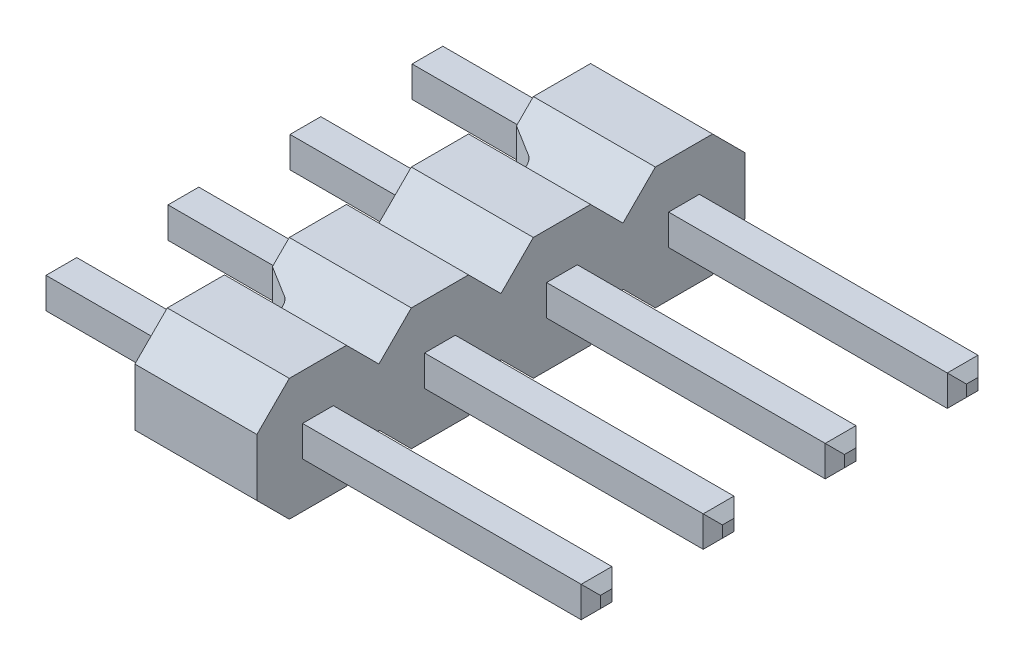
from build123d import *

# Parameters (mm, degrees)
CROQUIS1_W                     = 0.64
CROQUIS1_H                     = 0.64
SALIENTE_EXTRUIR1_DEPTH        = 2.54
CORTAR_EXTRUIR1_DEPTH          = 2.54
CORTAR_EXTRUIR1_DEPTH_BACK     = 2.54
SALIENTE_EXTRUIR2_DEPTH        = 8.54
SALIENTE_EXTRUIR2_DEPTH_BACK   = 3
CROQUIS3_W                     = 0.64
CROQUIS3_H                     = 0.64
SALIENTE_EXTRUIR2_2_DEPTH      = 8.54
SALIENTE_EXTRUIR2_2_DEPTH_BACK = 3
CHAFL_N1_SIZE                  = 0.2
CHAFL_N2_SIZE                  = 0.2


with BuildPart() as part:
    # Croquis1 → Saliente-Extruir1 (new body)
    # profile 1 of 2: a face of its own
    with BuildSketch(Plane(origin=(0, 0, 0), x_dir=(0, 0, -1), z_dir=(1, 0, 0))):
        Polygon((1.27, 0.595482683), (1.27, -0.595482683), (0.595482683, -1.27), (-0.595482683, -1.27), (-1.27, -0.595482683), (-1.27, 0.595482683), (-0.595482683, 1.27), (0.595482683, 1.27), align=None)
        Rectangle(CROQUIS1_W, CROQUIS1_H, mode=Mode.SUBTRACT)
    # profile 2 of 2: a face of its own
    with BuildSketch(Plane(origin=(0, 0, 0), x_dir=(0, 0, -1), z_dir=(1, 0, 0))):
        Polygon((3.135482683, 1.27), (3.81, 0.595482683), (3.81, -0.595482683), (3.135482683, -1.27), (1.944517317, -1.27), (1.27, -0.595482683), (1.27, 0.595482683), (1.944517317, 1.27), align=None)
        with Locations((2.54, 0)):
            Rectangle(CROQUIS1_W, CROQUIS1_H, mode=Mode.SUBTRACT)
    extrude(amount=SALIENTE_EXTRUIR1_DEPTH)

    # Croquis2 → Cortar-Extruir1 (cut, two sides: drawn at the far end of the back side and taken through both)
    with BuildSketch(Plane(origin=(0, 0, 0), x_dir=(1, 0, 0), z_dir=(0, 1, 0)).offset(-CORTAR_EXTRUIR1_DEPTH_BACK)):
        with BuildLine():
            Line((0.516526244, 1.243275937), (0.516526244, 1.296724063))
            ThreePointArc((0.516526244, 1.296724063), (0.500491193, 1.351036929), (0.457528496, 1.387931603))
            Line((0.457528496, 1.387931603), (0, 1.593613049))
            Line((0, 1.593613049), (0, 0.946386951))
            Line((0, 0.946386951), (0.457528496, 1.152068397))
            ThreePointArc((0.457528496, 1.152068397), (0.500491193, 1.188963071), (0.516526244, 1.243275937))
        make_face()
    extrude(amount=CORTAR_EXTRUIR1_DEPTH + CORTAR_EXTRUIR1_DEPTH_BACK, mode=Mode.SUBTRACT)

    # Mirror5: part across plane


with BuildPart() as body_2:
    # Croquis3 → Saliente-Extruir2 (new, two sides: drawn at the far end of the back side and taken through both)
    with BuildSketch(Plane(origin=(0, 0, 0), x_dir=(0, 0, -1), z_dir=(1, 0, 0)).offset(-SALIENTE_EXTRUIR2_DEPTH_BACK)):
        Rectangle(CROQUIS3_W, CROQUIS3_H)
    extrude(amount=SALIENTE_EXTRUIR2_DEPTH + SALIENTE_EXTRUIR2_DEPTH_BACK)

    # Chaflán1
    chafl_n1_edges = [body_2.edges().sort_by_distance(p)[0] for p in [
        (-3, 0, -0.32),
        (8.54, 0, 0.32),
        (8.54, -0.32, 0),
        (-3, 0.32, 0),
        (8.54, 0, -0.32),
        (8.54, 0.32, 0),
        (-3, 0, 0.32),
        (-3, -0.32, 0),
    ]]
    chamfer(chafl_n1_edges, length=CHAFL_N1_SIZE)


with BuildPart() as body_3:
    # Croquis3 → Saliente-Extruir2 2 (new, two sides: drawn at the far end of the back side and taken through both)
    with BuildSketch(Plane(origin=(0, 0, 0), x_dir=(0, 0, -1), z_dir=(1, 0, 0)).offset(-SALIENTE_EXTRUIR2_2_DEPTH_BACK)):
        with Locations((2.54, 0)):
            Rectangle(CROQUIS3_W, CROQUIS3_H)
    extrude(amount=SALIENTE_EXTRUIR2_2_DEPTH + SALIENTE_EXTRUIR2_2_DEPTH_BACK)

    # Chaflán2
    chafl_n2_edges = [body_3.edges().sort_by_distance(p)[0] for p in [
        (-3, 0, -2.86),
        (8.54, 0, -2.22),
        (8.54, -0.32, -2.54),
        (-3, 0.32, -2.54),
        (8.54, 0, -2.86),
        (8.54, 0.32, -2.54),
        (-3, 0, -2.22),
        (-3, -0.32, -2.54),
    ]]
    chamfer(chafl_n2_edges, length=CHAFL_N2_SIZE)


with BuildPart() as body_4:
    # Mirror3: mirrored copy
    add(body_2.part.mirror(Plane(origin=(2.54, 0, 1.27), x_dir=(1, 0, 0), z_dir=(0, 0, -1))))


with BuildPart() as body_5:
    # Mirror3 2: mirrored copy
    add(body_3.part.mirror(Plane(origin=(2.54, 0, 1.27), x_dir=(1, 0, 0), z_dir=(0, 0, -1))))


with BuildPart() as part_1:
    add(part.part)
    add(part.part.mirror(Plane(origin=(2.54, 0, 1.27), x_dir=(1, 0, 0), z_dir=(0, 0, -1))))


solid = Compound([body_2.part, body_3.part, body_4.part, body_5.part, part_1.part])
